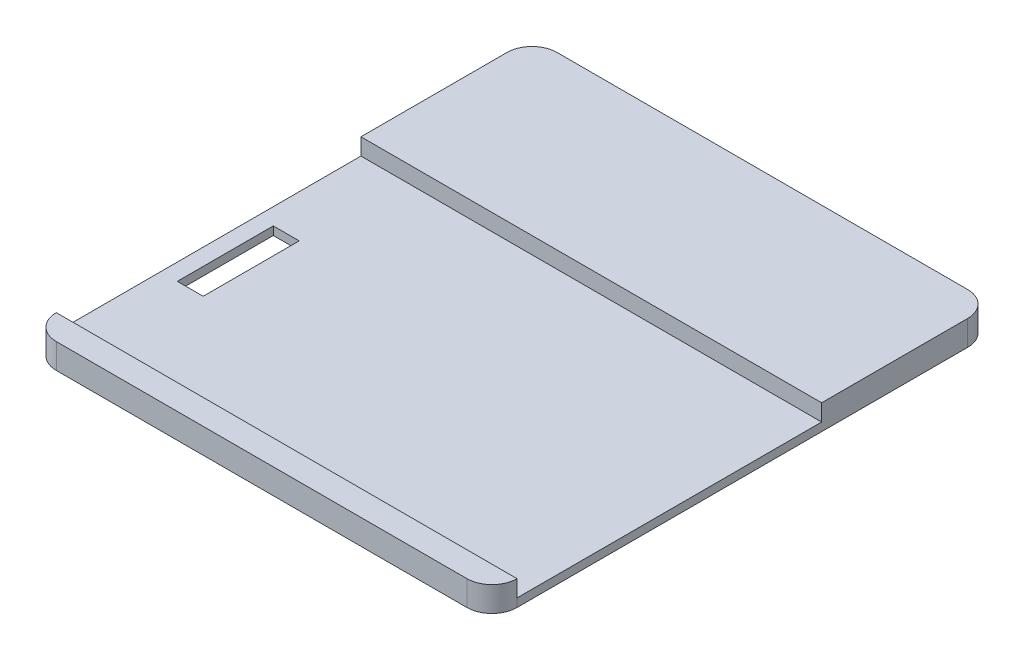
from build123d import *

# Parameters (mm, degrees)
BOSS_EXTRUDE1_DEPTH   = 3
BOSS_EXTRUDE1_2_DEPTH = 3
SKETCH1_5_W           = 55.2
SKETCH1_5_H           = 36.5
SKETCH1_5_W_2         = 3.1
SKETCH1_5_H_2         = 11.5
BOSS_EXTRUDE2_DEPTH   = 1


with BuildPart() as part:
    # Sketch1 → Boss-Extrude1 (new body)
    with BuildSketch(Plane(origin=(0, 0, 0), x_dir=(1, 0, 0), z_dir=(0, 1, 0))):
        with BuildLine():
            ThreePointArc((-27.6, -27), (-26.721320344, -29.121320344), (-24.6, -30))
            Line((-24.6, -30), (24.6, -30))
            ThreePointArc((24.6, -30), (26.721320344, -29.121320344), (27.6, -27))
            Line((27.6, -27), (-27.6, -27))
        make_face()
    extrude(amount=BOSS_EXTRUDE1_DEPTH)



with BuildPart() as body_2:
    # Sketch1 → Boss-Extrude1 2 (new body)
    with BuildSketch(Plane(origin=(0, 0, 0), x_dir=(1, 0, 0), z_dir=(0, 1, 0))):
        with BuildLine():
            Line((-27.6, 27), (-27.6, 9.5))
            Line((-27.6, 9.5), (27.6, 9.5))
            Line((27.6, 9.5), (27.6, 27))
            ThreePointArc((27.6, 27), (26.721320344, 29.121320344), (24.6, 30))
            Line((24.6, 30), (-24.6, 30))
            ThreePointArc((-24.6, 30), (-26.721320344, 29.121320344), (-27.6, 27))
        make_face()
    extrude(amount=BOSS_EXTRUDE1_2_DEPTH)


with BuildPart() as part_1:
    add(part.part)

    add(body_2.part)  # Boss-Extrude2 merges body 2
    # Sketch1<5> → Boss-Extrude2 (add)
    with BuildSketch(Plane(origin=(0, 0, 0), x_dir=(1, 0, 0), z_dir=(0, 1, 0))):
        with Locations((0, -8.75)):
            Rectangle(SKETCH1_5_W, SKETCH1_5_H)
        with Locations((-24.05, -8.75)):
            Rectangle(SKETCH1_5_W_2, SKETCH1_5_H_2, mode=Mode.SUBTRACT)
    extrude(amount=BOSS_EXTRUDE2_DEPTH)


solid = part_1.part
